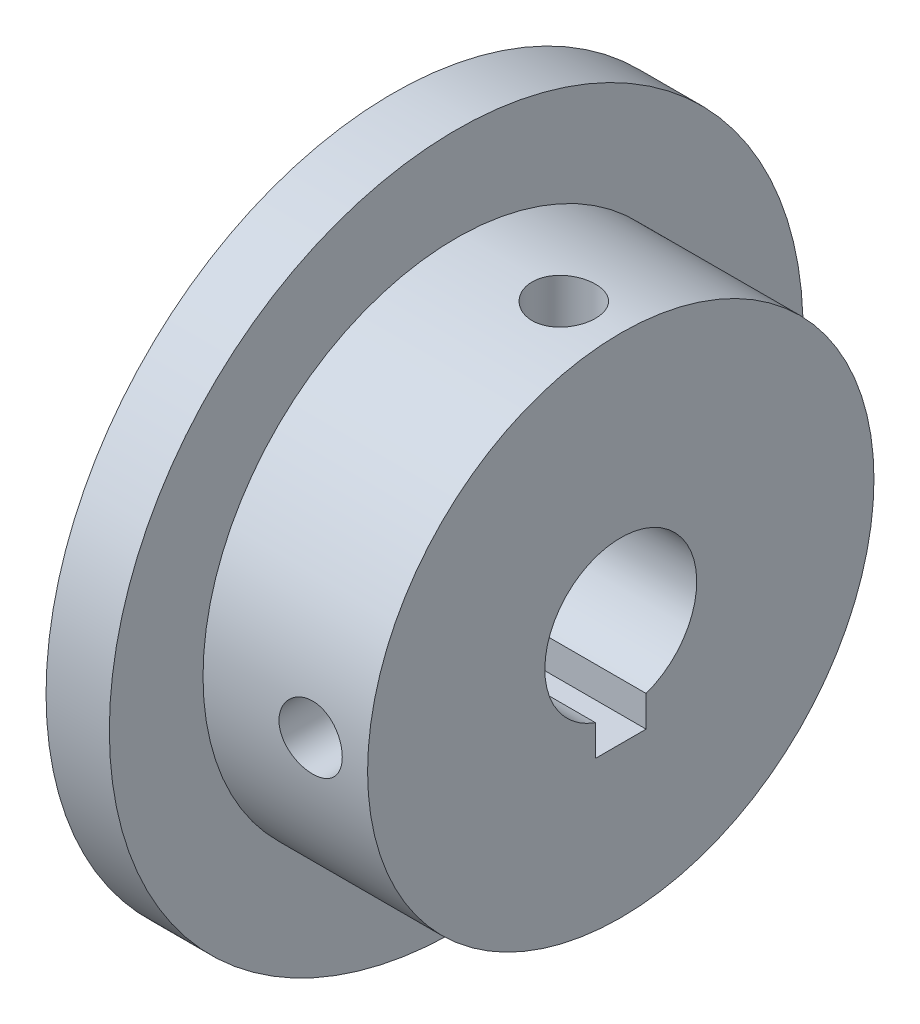
from build123d import *

# Parameters (mm, degrees)
SKETCH_2_R               = 6
CUT_EXTRUDE_1_DEPTH      = 45.55917414
HOLE_WIZARD_M6_1_REACH   = 58.389
HOLE_WIZARD_M6_1_BORE_R  = 2.5
PATTERN_CIRCULAR_1_COUNT = 2
PATTERN_CIRCULAR_1_ANGLE = 90
CUT_EXTRUDE_2_REACH      = 46.559
SKETCH_4_W               = 4
SKETCH_4_H               = 4.2
SKETCH_5_R               = 20
CUT_EXTRUDE_3_DEPTH      = 4


with BuildPart() as part:
    # 草图1 → 旋转1 (revolve)
    with BuildSketch(Plane.XY, mode=Mode.PRIVATE) as revolve_1_sk:
        Polygon((0, 0), (0, 27.4), (5, 27.4), (5, 20), (22, 20), (22, 0), align=None)
    revolve(revolve_1_sk.sketch.rotate(Axis((0, 0, 0), (1, 0, 0)), 90), axis=Axis((0, 0, 0), (1, 0, 0)))

    # 草图2 → 切除-拉伸1 (cut, through all)
    with BuildSketch(Plane.ZY):
        Circle(SKETCH_2_R)
    extrude(amount=-CUT_EXTRUDE_1_DEPTH, mode=Mode.SUBTRACT)

    # M6 螺纹孔1 bore (on position points) → M6 螺纹孔1 (cut, up to next)
    with BuildSketch(Plane(origin=(13.5, 0, 20), x_dir=(1, 0, 0), z_dir=(0, 0, 1)), mode=Mode.PRIVATE) as hole_wizard_m6_1_sk1:
        Circle(HOLE_WIZARD_M6_1_BORE_R)
    hole_wizard_m6_1_tool1 = extrude(hole_wizard_m6_1_sk1.sketch, amount=-HOLE_WIZARD_M6_1_REACH, mode=Mode.PRIVATE) & part.part
    hole_wizard_m6_1 = hole_wizard_m6_1_tool1.solids().sort_by_distance((13.5, 0, 20))[0]
    add(hole_wizard_m6_1, mode=Mode.SUBTRACT)

    # 阵列(圆周)1: M6 螺纹孔1 ×2 about axis
    pattern_circular_1_axis = Axis((22, 0, 0), (-1, 0, 0))
    for i in range(1, PATTERN_CIRCULAR_1_COUNT):
        add(hole_wizard_m6_1.rotate(pattern_circular_1_axis, i * PATTERN_CIRCULAR_1_ANGLE / (PATTERN_CIRCULAR_1_COUNT - 1)), mode=Mode.SUBTRACT)

    # 草图4 → 切除-拉伸2 (cut, up to next)
    with BuildSketch(Plane.ZY, mode=Mode.PRIVATE) as cut_extrude_2_sk1:
        with Locations((0, -6)):
            Rectangle(SKETCH_4_W, SKETCH_4_H)
    cut_extrude_2_tool1 = extrude(cut_extrude_2_sk1.sketch, amount=-CUT_EXTRUDE_2_REACH, mode=Mode.PRIVATE) & part.part
    add(cut_extrude_2_tool1.solids().sort_by_distance((0, -6, 0))[0], mode=Mode.SUBTRACT)

    # 草图5 → 切除-拉伸3 (cut)
    with BuildSketch(Plane(origin=(22, 0, 0), x_dir=(0, 0, -1), z_dir=(1, 0, 0))):
        with Locations(Location((0, 0, 0), (0, 0, 180))):
            Circle(SKETCH_5_R)
    extrude(amount=-CUT_EXTRUDE_3_DEPTH, mode=Mode.SUBTRACT)


solid = part.part
